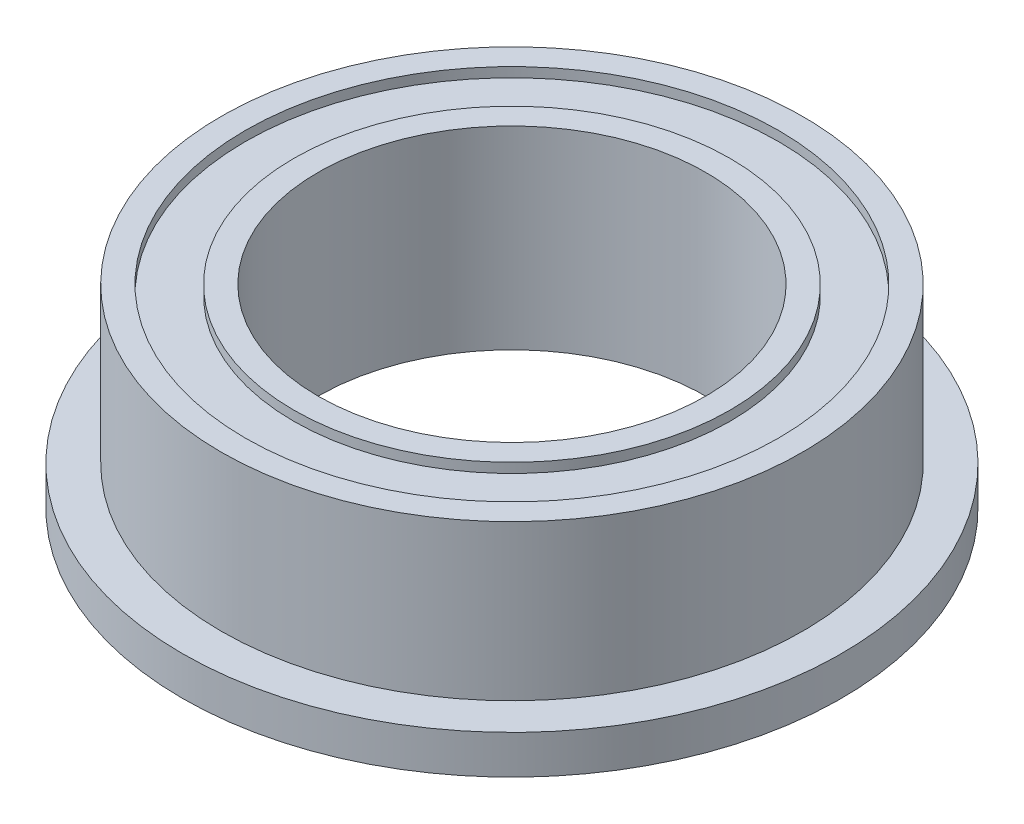
from build123d import *

# Parameters (mm, degrees)
SKETCH_1_R          = 6
SKETCH_1_R_2        = 4
EXTRUDE_1_DEPTH     = 4
SKETCH_2_R          = 6.8
SKETCH_2_R_2        = 6
EXTRUDE_2_DEPTH     = 0.8
SKETCH_3_R          = 5.5
SKETCH_3_R_2        = 4.5
CUT_EXTRUDE_1_DEPTH = 0.2


with BuildPart() as part:
    # 草图1 → 凸台-拉伸1 (new body)
    with BuildSketch(Plane(origin=(0, 0, 0), x_dir=(1, 0, 0), z_dir=(0, 1, 0))):
        with Locations(Location((0, 0, 0), (0, 0, 270))):
            Circle(SKETCH_1_R)
        with Locations(Location((0, 0, 0), (0, 0, 270))):
            Circle(SKETCH_1_R_2, mode=Mode.SUBTRACT)
    extrude(amount=EXTRUDE_1_DEPTH)

    # 草图2 → 凸台-拉伸2 (add)
    with BuildSketch(Plane(origin=(0, 0, 0), x_dir=(1, 0, 0), z_dir=(0, 1, 0))):
        with Locations(Location((0, 0, 0), (0, 0, 270))):
            Circle(SKETCH_2_R)
        with Locations(Location((0, 0, 0), (0, 0, 270))):
            Circle(SKETCH_2_R_2, mode=Mode.SUBTRACT)
    extrude(amount=EXTRUDE_2_DEPTH)

    # 草图3 → 切除-拉伸1 (cut)
    with BuildSketch(Plane(origin=(0, 4, 0), x_dir=(1, 0, 0), z_dir=(0, 1, 0))):
        with Locations(Location((0, 0, 0), (0, 0, 270))):
            Circle(SKETCH_3_R)
        with Locations(Location((0, 0, 0), (0, 0, 270))):
            Circle(SKETCH_3_R_2, mode=Mode.SUBTRACT)
    cut_extrude_1 = extrude(amount=-CUT_EXTRUDE_1_DEPTH, mode=Mode.SUBTRACT)

    # 镜向1: 切除-拉伸1 across plane
    add(cut_extrude_1.mirror(Plane.ZX.offset(2)), mode=Mode.SUBTRACT)


solid = part.part
